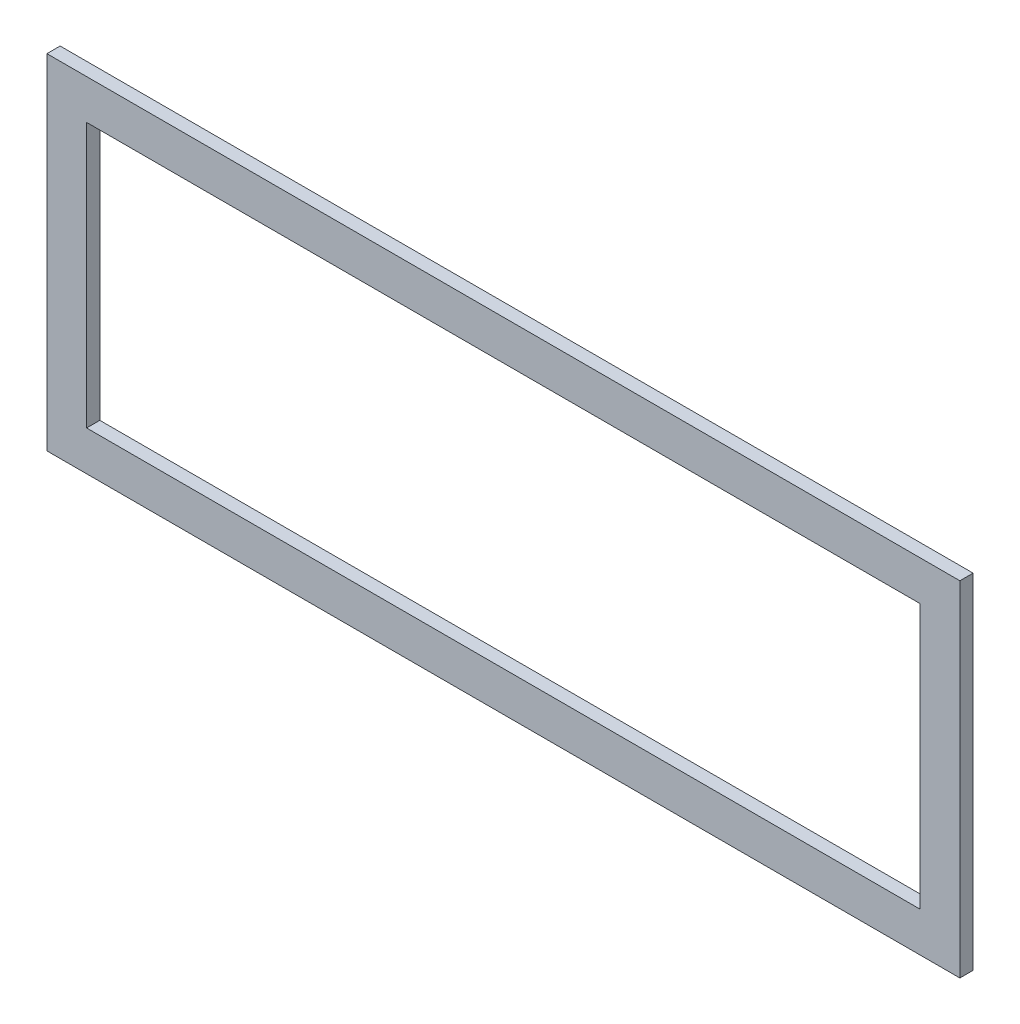
from build123d import *

# Parameters (mm, degrees)
SKETCH1_W     = 138
SKETCH1_H     = 52
SKETCH1_W_2   = 126
SKETCH1_H_2   = 40
PROFILE_DEPTH = 2


with BuildPart() as part:
    # Sketch1 → Profile (new body)
    with BuildSketch(Plane.XY):
        with Locations((69, 26)):
            Rectangle(SKETCH1_W, SKETCH1_H)
        with Locations((69, 26)):
            Rectangle(SKETCH1_W_2, SKETCH1_H_2, mode=Mode.SUBTRACT)
    extrude(amount=PROFILE_DEPTH)


solid = part.part
